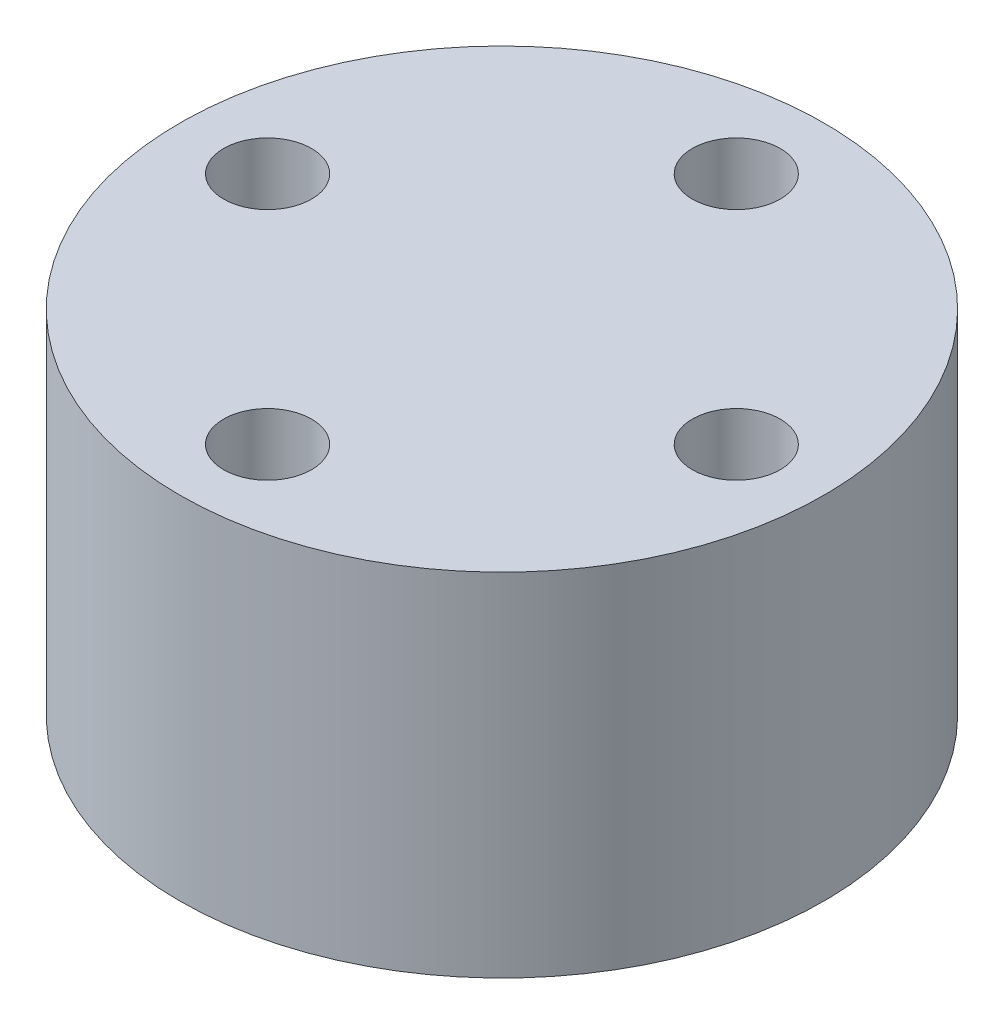
from build123d import *

# Parameters (mm, degrees)
SKETCH_1_R      = 11
SKETCH_1_R_2    = 1.5
EXTRUDE_1_DEPTH = 12


with BuildPart() as part:
    # 草图1 → 凸台-拉伸1 (new body)
    with BuildSketch(Plane(origin=(0, 0, 0), x_dir=(1, 0, 0), z_dir=(0, 1, 0))):
        with Locations(Location((0, 0, 0), (0, 0, 270))):
            Circle(SKETCH_1_R)
        with Locations(Location((0, 8, 0), (0, 0, 270))):
            Circle(SKETCH_1_R_2, mode=Mode.SUBTRACT)
        with Locations(Location((8, 0, 0), (0, 0, 270))):
            Circle(SKETCH_1_R_2, mode=Mode.SUBTRACT)
        with Locations(Location((0, -8, 0), (0, 0, 270))):
            Circle(SKETCH_1_R_2, mode=Mode.SUBTRACT)
        with Locations(Location((-8, 0, 0), (0, 0, 270))):
            Circle(SKETCH_1_R_2, mode=Mode.SUBTRACT)
    extrude(amount=EXTRUDE_1_DEPTH)


solid = part.part
